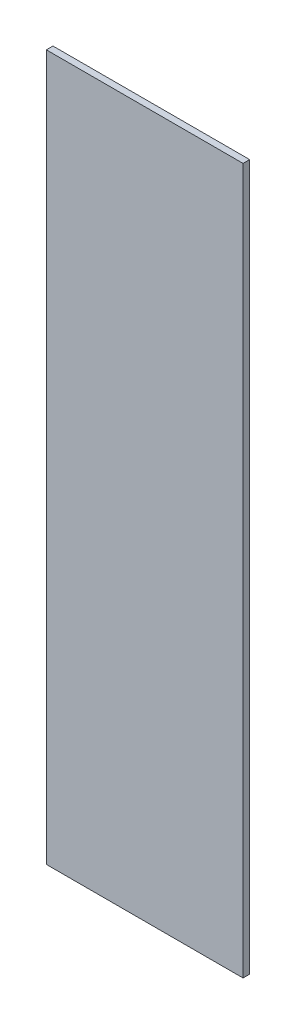
from build123d import *

# Parameters (mm, degrees)
SKETCH_1_W      = 148.63
SKETCH_1_H      = 5
EXTRUDE_1_DEPTH = 533


with BuildPart() as part:
    # Эскиз1 → Вытянуть1 (new body)
    with BuildSketch(Plane(origin=(0, 0, 0), x_dir=(1, 0, 0), z_dir=(0, 1, 0))):
        with Locations((74.315, -2.5)):
            Rectangle(SKETCH_1_W, SKETCH_1_H)
    extrude(amount=EXTRUDE_1_DEPTH)


solid = part.part
